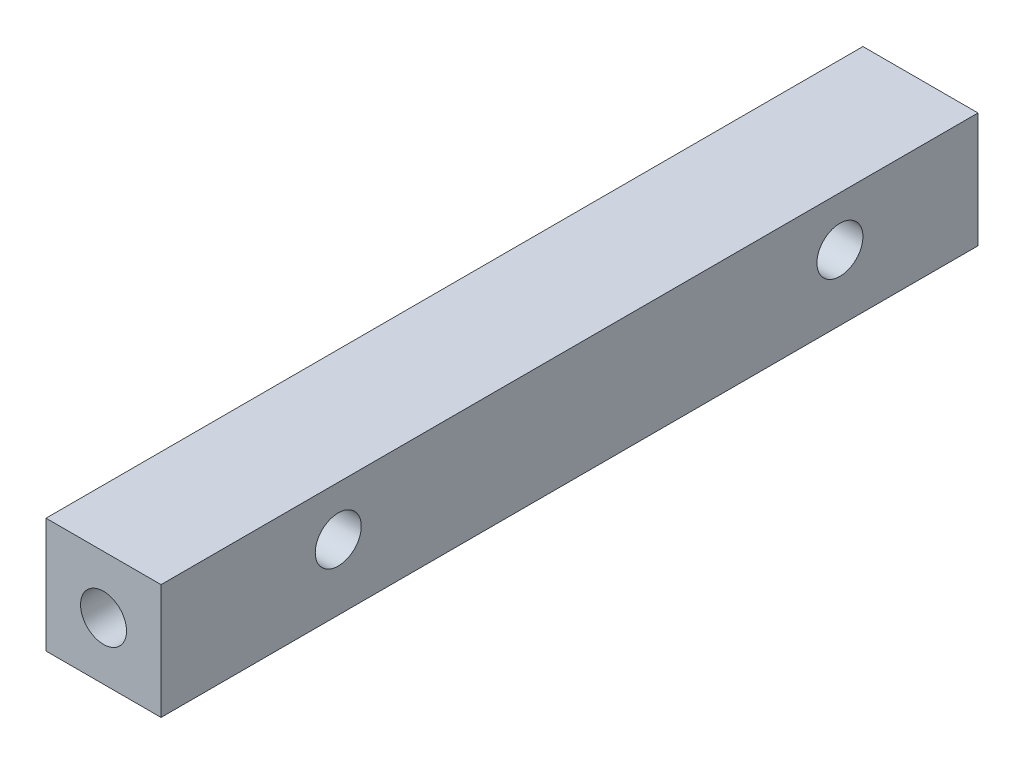
from build123d import *

# Parameters (mm, degrees)
ESQUISSE1_W             = 10
ESQUISSE1_H             = 10
BOSS_EXTRU_1_DEPTH      = 71
ESQUISSE2_R             = 2
ENL_V_MAT_EXTRU_1_DEPTH = 73.394751191
ESQUISSE3_R             = 2
ENL_V_MAT_EXTRU_2_DEPTH = 6
ENL_V_START             = -6
ESQUISSE4_R             = 2
ENL_V_MAT_EXTRU_3_DEPTH = 6


with BuildPart() as part:
    # Esquisse1 → Boss.-Extru.1 (new body)
    with BuildSketch(Plane.XY):
        with Locations((5, 5)):
            Rectangle(ESQUISSE1_W, ESQUISSE1_H)
    extrude(amount=BOSS_EXTRU_1_DEPTH)

    # Esquisse2 → Enlèv. mat.-Extru.1 (cut, through all)
    with BuildSketch(Plane.ZY):
        with Locations((12, 5.7)):
            Circle(ESQUISSE2_R)
        with Locations((55.6, 5.7)):
            Circle(ESQUISSE2_R)
    extrude(amount=-ENL_V_MAT_EXTRU_1_DEPTH, mode=Mode.SUBTRACT)

    # Esquisse3 → Enlèv. mat.-Extru.2 (cut)
    with BuildSketch(Plane(origin=(0, 0, 0), x_dir=(-1, 0, 0), z_dir=(0, 0, -1))):
        with Locations((-5, 5)):
            Circle(ESQUISSE3_R)
    extrude(amount=-ENL_V_MAT_EXTRU_2_DEPTH, mode=Mode.SUBTRACT)

    # Esquisse4 → Enlèv. mat.-Extru.3 (cut)
    with BuildSketch(Plane.XY.offset(71).offset(ENL_V_START)):
        with Locations(Location((5, 5, 0), (0, 0, 180))):
            Circle(ESQUISSE4_R)
    extrude(amount=ENL_V_MAT_EXTRU_3_DEPTH, mode=Mode.SUBTRACT)


solid = part.part
